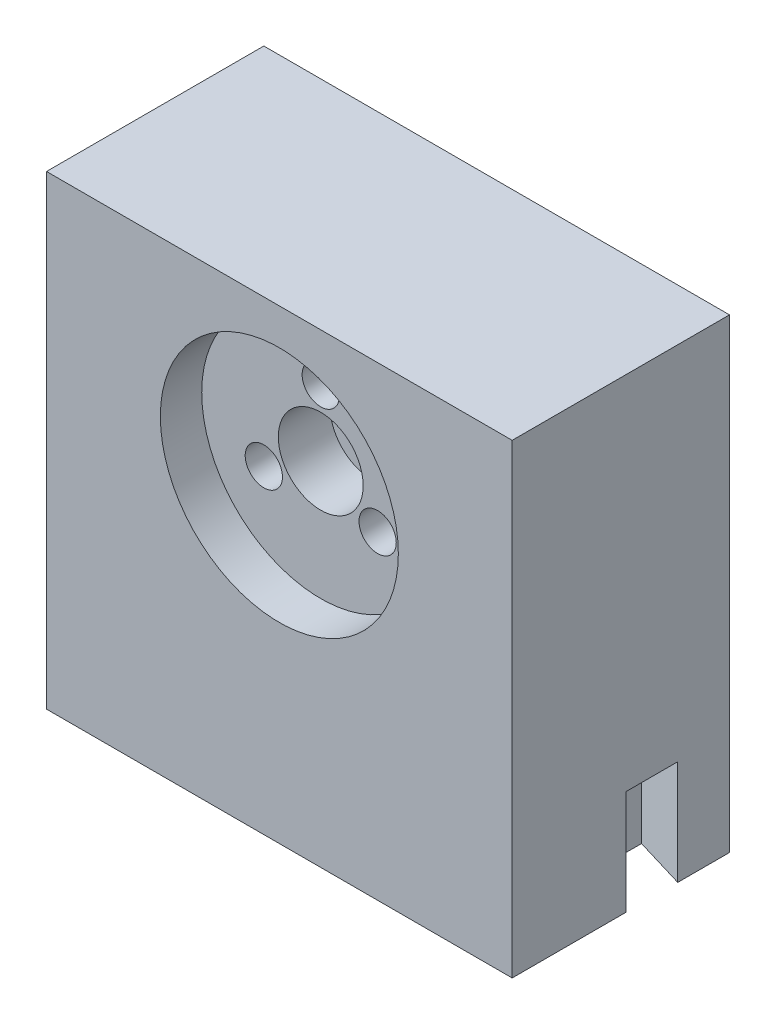
from build123d import *

# Parameters (mm, degrees)
SKETCH1_W           = 45
SKETCH1_H           = 45
BOSS_EXTRUDE1_DEPTH = 15
CUT_EXTRUDE1_DEPTH  = 66.383484153
CUT_EXTRUDE2_DEPTH  = 10.1
SKETCH4_W           = 45
SKETCH4_H           = 45
BOSS_EXTRUDE2_DEPTH = 3
SKETCH5_R           = 17.5
CUT_EXTRUDE3_DEPTH  = 3
SKETCH6_W           = 45
SKETCH6_H           = 45
BOSS_EXTRUDE3_DEPTH = 3
SKETCH7_R           = 2.6
CUT_EXTRUDE4_DEPTH  = 68.014923711
SKETCH8_R           = 1.8
CUT_EXTRUDE5_DEPTH  = 68.014923711
SKETCH9_R           = 11.5
CUT_EXTRUDE6_DEPTH  = 4
SKETCH10_R          = 4.1
CUT_EXTRUDE7_DEPTH  = 5


with BuildPart() as part:
    # Sketch1 → Boss-Extrude1 (new body)
    with BuildSketch(Plane.XY):
        with Locations((22.5, 22.5)):
            Rectangle(SKETCH1_W, SKETCH1_H)
    extrude(amount=BOSS_EXTRUDE1_DEPTH)

    # Sketch2 → Cut-Extrude1 (cut, through all)
    with BuildSketch(Plane.XY.offset(15)):
        Polygon((14.5, 0), (30.5, 0), (30.5, 2), (23.5, 2), (23.5, 10), (21.5, 10), (21.5, 2), (14.5, 2), align=None)
    extrude(amount=-CUT_EXTRUDE1_DEPTH, mode=Mode.SUBTRACT)

    # Sketch3 → Cut-Extrude2 (cut)
    with BuildSketch(Plane.XZ):
        Polygon((45, 10), (40, 11.5), (40, 3.5), (45, 5), align=None)
    cut_extrude2 = extrude(amount=-CUT_EXTRUDE2_DEPTH, mode=Mode.SUBTRACT)

    # Mirror1: Cut-Extrude2 across plane
    add(cut_extrude2.mirror(Plane(origin=(22.5, 0, 0), x_dir=(0, 0, 1), z_dir=(1, 0, 0))), mode=Mode.SUBTRACT)

    # Sketch4 → Boss-Extrude2 (add)
    with BuildSketch(Plane.XY.offset(15)):
        with Locations((22.5, 22.5)):
            Rectangle(SKETCH4_W, SKETCH4_H)
    extrude(amount=BOSS_EXTRUDE2_DEPTH)

    # Sketch5 → Cut-Extrude3 (cut)
    with BuildSketch(Plane.XY.offset(18)):
        with Locations((22.5, 0)):
            Circle(SKETCH5_R)
    extrude(amount=-CUT_EXTRUDE3_DEPTH, mode=Mode.SUBTRACT)

    # Sketch6 → Boss-Extrude3 (add)
    with BuildSketch(Plane.XY.offset(18)):
        with Locations((22.5, 22.5)):
            Rectangle(SKETCH6_W, SKETCH6_H)
    extrude(amount=BOSS_EXTRUDE3_DEPTH)

    # Sketch7 → Cut-Extrude4 (cut, through all)
    with BuildSketch(Plane.XY.offset(21)):
        with Locations((22.5, 30)):
            Circle(SKETCH7_R)
    extrude(amount=-CUT_EXTRUDE4_DEPTH, mode=Mode.SUBTRACT)

    # Sketch8 → Cut-Extrude5 (cut, through all)
    with BuildSketch(Plane.XY.offset(21)):
        with Locations((22.5, 36.35)):
            Circle(SKETCH8_R)
        with Locations((27.999261314, 26.825)):
            Circle(SKETCH8_R)
        with Locations((17.000738686, 26.825)):
            Circle(SKETCH8_R)
    extrude(amount=-CUT_EXTRUDE5_DEPTH, mode=Mode.SUBTRACT)

    # Sketch9 → Cut-Extrude6 (cut)
    with BuildSketch(Plane.XY.offset(21)):
        with Locations((22.5, 30)):
            Circle(SKETCH9_R)
    extrude(amount=-CUT_EXTRUDE6_DEPTH, mode=Mode.SUBTRACT)

    # Sketch10 → Cut-Extrude7 (cut)
    with BuildSketch(Plane.XY.offset(17)):
        with Locations((22.5, 30)):
            Circle(SKETCH10_R)
    extrude(amount=-CUT_EXTRUDE7_DEPTH, mode=Mode.SUBTRACT)


solid = part.part
